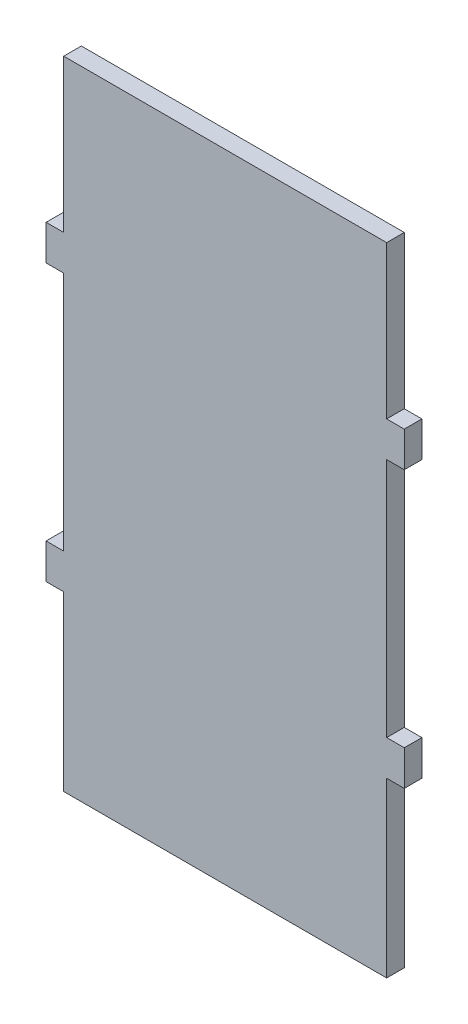
from build123d import *

# Parameters (mm, degrees)
P_IDAT_VYSUNUT_M1_DEPTH = 3


with BuildPart() as part:
    # Skica1 → Přidat vysunutím1 (new body)
    with BuildSketch(Plane.XY):
        Polygon((0, 0), (55, 0), (55, -26), (58, -26), (58, -32), (55, -32), (55, -73), (58, -73), (58, -79), (55, -79), (55, -108.46), (0, -108.46), (0, -79), (-3, -79), (-3, -73), (0, -73), (0, -32), (-3, -32), (-3, -26), (0, -26), align=None)
    extrude(amount=P_IDAT_VYSUNUT_M1_DEPTH)


solid = part.part
